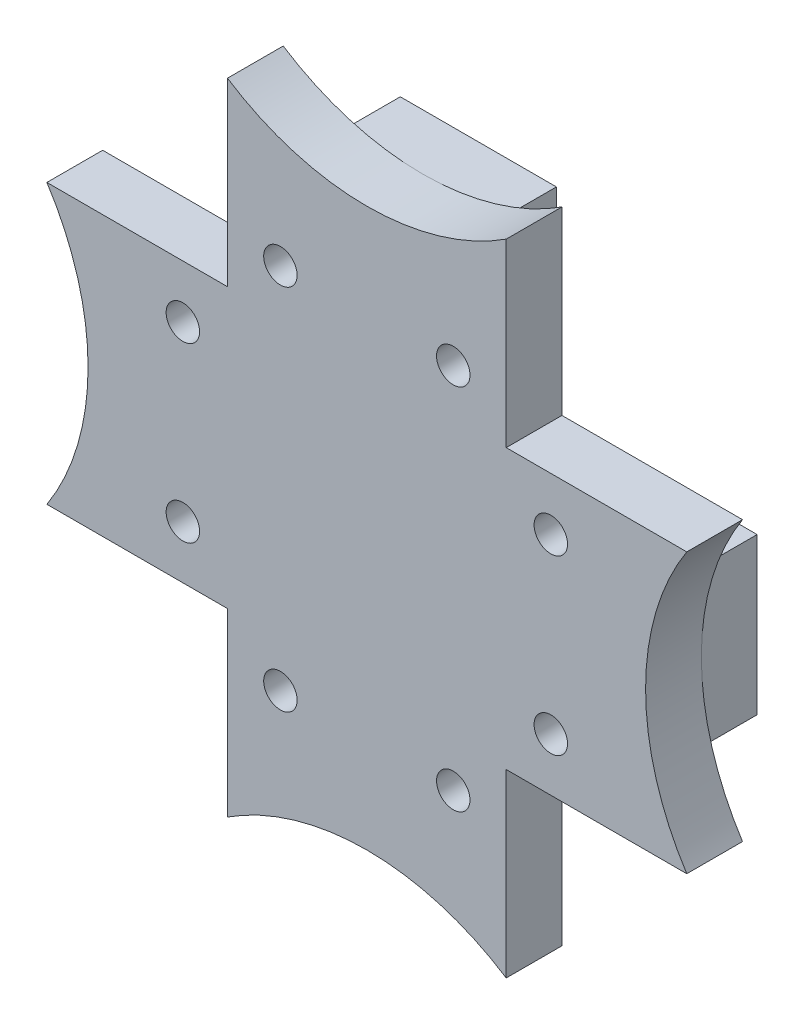
from build123d import *

# Parameters (mm, degrees)
SKETCH2_R           = 1.5
BOSS_EXTRUDE1_DEPTH = 5
BOSS_EXTRUDE2_DEPTH = 5


with BuildPart() as part:
    # Sketch2 → Boss-Extrude1 (new body)
    with BuildSketch(Plane.XY):
        with BuildLine():
            Line((-12.5, -3.693265424), (-12.5, 25))
            Line((-12.5, 25), (12.5, 25))
            Line((12.5, 25), (12.5, -3.693265424))
            ThreePointArc((12.5, -3.693265424), (0, 0), (-12.5, -3.693265424))
        make_face()
        with Locations((-7.751243347, 8.5)):
            Circle(SKETCH2_R, mode=Mode.SUBTRACT)
        with Locations((7.751243347, 8.5)):
            Circle(SKETCH2_R, mode=Mode.SUBTRACT)
    extrude(amount=BOSS_EXTRUDE1_DEPTH)

    # Sketch3 → Boss-Extrude2 (add)
    with BuildSketch(Plane(origin=(0, 0, 0), x_dir=(-1, 0, 0), z_dir=(0, 0, -1))):
        Polygon((2.502486694, 11.5), (2.502486694, 25), (-2.502486694, 25), (-2.502486694, 11.5), (-2.502486694, 3.5), (-2.502486694, 3), (-7, 3), (-7, 0.5), (-7, 0), (7, 0), (7, 0.5), (7, 3), (2.502486694, 3), (2.502486694, 3.5), align=None)
    extrude(amount=BOSS_EXTRUDE2_DEPTH)

    # Mirror1: part across plane


with BuildPart() as part_1:
    add(part.part)
    add(part.part.mirror(Plane(origin=(-12.5, 25, 5), x_dir=(0, 0, 1), z_dir=(0, -1, 0))))

    # Mirror2: part across plane


with BuildPart() as part_2:
    add(part_1.part)
    add(part_1.part.mirror(Plane(origin=(12.5, 12.5, 0), x_dir=(0, 0, 1), z_dir=(0.7071067811865488, 0.7071067811865464, 0))))


solid = part_2.part
